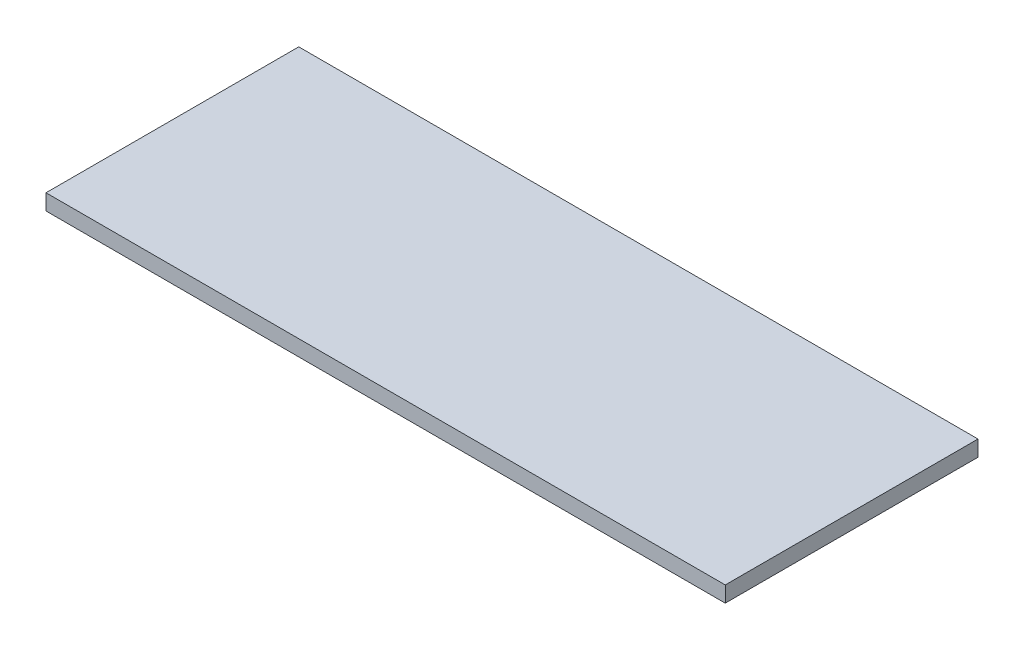
from build123d import *

# Parameters (mm, degrees)
SKETCH1_W           = 129
SKETCH1_H           = 48
BOSS_EXTRUDE1_DEPTH = 3


with BuildPart() as part:
    # Sketch1 → Boss-Extrude1 (new body)
    with BuildSketch(Plane(origin=(0, 0, 0), x_dir=(1, 0, 0), z_dir=(0, 1, 0))):
        Rectangle(SKETCH1_W, SKETCH1_H)
    extrude(amount=BOSS_EXTRUDE1_DEPTH)


solid = part.part
